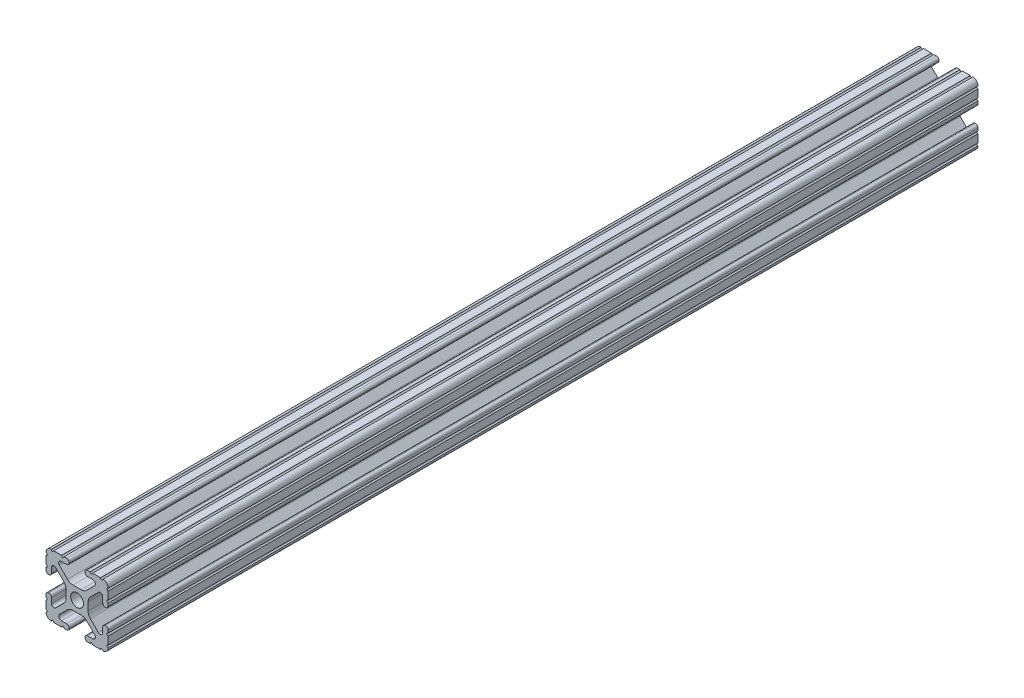
from build123d import *

# Parameters (mm, degrees)
SKETCH1_R           = 2.6035
BOSS_EXTRUDE1_DEPTH = 177.8


with BuildPart() as part:
    # Sketch1 → Boss-Extrude1 (new, symmetric)
    with BuildSketch(Plane.XY):
        with BuildLine():
            Line((-7.179650497, -8.645192506), (-3.952270251, -5.423690499))
            ThreePointArc((-3.952270251, -5.423690499), (-2.922936451, -4.736929036), (-1.709253557, -4.4958))
            Line((-1.709253557, -4.4958), (1.709253557, -4.4958))
            ThreePointArc((1.709253557, -4.4958), (2.922936451, -4.736929036), (3.952270251, -5.423690499))
            Line((3.952270251, -5.423690499), (7.179650497, -8.645192506))
            ThreePointArc((7.179650497, -8.645192506), (7.41473083, -9.822813117), (6.416408329, -10.4902))
            Line((6.416408329, -10.4902), (4.287512407, -10.4902))
            ThreePointArc((4.287512407, -10.4902), (3.54574862, -10.79744862), (3.2385, -11.539212407))
            Line((3.2385, -11.539212407), (3.2385, -11.650987593))
            ThreePointArc((3.2385, -11.650987593), (3.54574862, -12.39275138), (4.287512407, -12.7))
            Line((4.287512407, -12.7), (5.317126718, -12.7))
            ThreePointArc((5.317126718, -12.7), (5.825126718, -12.192), (6.333126718, -12.7))
            Line((6.333126718, -12.7), (9.550443118, -12.7))
            ThreePointArc((9.550443118, -12.7), (10.058366869, -12.192000006), (10.566443095, -12.699847501))
            ThreePointArc((10.566443095, -12.699847501), (12.082537762, -12.08250727), (12.699846982, -10.566399977))
            ThreePointArc((12.699846982, -10.566399977), (12.192000006, -10.058323491), (12.7, -9.5504))
            Line((12.7, -9.5504), (12.7, -6.3330836))
            ThreePointArc((12.7, -6.3330836), (12.192, -5.8250836), (12.7, -5.3170836))
            Line((12.7, -5.3170836), (12.7, -4.287469289))
            ThreePointArc((12.7, -4.287469289), (12.39275138, -3.545705502), (11.650987593, -3.238456882))
            Line((11.650987593, -3.238456882), (11.539212407, -3.238456882))
            ThreePointArc((11.539212407, -3.238456882), (10.79744862, -3.545705502), (10.4902, -4.287469289))
            Line((10.4902, -4.287469289), (10.4902, -6.402089023))
            ThreePointArc((10.4902, -6.402089023), (9.856505071, -7.351067942), (8.737131347, -7.129408934))
            Line((8.737131347, -7.129408934), (5.441005833, -3.840816462))
            ThreePointArc((5.441005833, -3.840816462), (4.750877967, -2.809883091), (4.5085, -1.593185507))
            Line((4.5085, -1.593185507), (4.5085, 1.593185507))
            ThreePointArc((4.5085, 1.593185507), (4.750877967, 2.809883091), (5.441005833, 3.840816462))
            Line((5.441005833, 3.840816462), (8.737131347, 7.129408934))
            ThreePointArc((8.737131347, 7.129408934), (9.856505071, 7.351067942), (10.4902, 6.402089023))
            Line((10.4902, 6.402089023), (10.4902, 4.287469289))
            ThreePointArc((10.4902, 4.287469289), (10.79744862, 3.545705502), (11.539212407, 3.238456882))
            Line((11.539212407, 3.238456882), (11.650987593, 3.238456882))
            ThreePointArc((11.650987593, 3.238456882), (12.39275138, 3.545705502), (12.7, 4.287469289))
            Line((12.7, 4.287469289), (12.7, 5.3170836))
            ThreePointArc((12.7, 5.3170836), (12.192, 5.8250836), (12.7, 6.3330836))
            Line((12.7, 6.3330836), (12.7, 9.5504))
            ThreePointArc((12.7, 9.5504), (12.192000006, 10.058323491), (12.699846982, 10.566399977))
            ThreePointArc((12.699846982, 10.566399977), (12.082537762, 12.08250727), (10.566443095, 12.699847501))
            ThreePointArc((10.566443095, 12.699847501), (10.058366869, 12.192000006), (9.550443118, 12.7))
            Line((9.550443118, 12.7), (6.333126718, 12.7))
            ThreePointArc((6.333126718, 12.7), (5.825126718, 12.192), (5.317126718, 12.7))
            Line((5.317126718, 12.7), (4.287512407, 12.7))
            ThreePointArc((4.287512407, 12.7), (3.54574862, 12.39275138), (3.2385, 11.650987593))
            Line((3.2385, 11.650987593), (3.2385, 11.539212407))
            ThreePointArc((3.2385, 11.539212407), (3.54574862, 10.79744862), (4.287512407, 10.4902))
            Line((4.287512407, 10.4902), (6.476788598, 10.4902))
            ThreePointArc((6.476788598, 10.4902), (7.432222385, 9.85140422), (7.207036008, 8.724370562))
            Line((7.207036008, 8.724370562), (3.898272566, 5.423169045))
            ThreePointArc((3.898272566, 5.423169045), (2.869120213, 4.736787962), (1.655778399, 4.4958))
            Line((1.655778399, 4.4958), (-1.655778399, 4.4958))
            ThreePointArc((-1.655778399, 4.4958), (-2.869120213, 4.736787962), (-3.898272566, 5.423169045))
            Line((-3.898272566, 5.423169045), (-7.207036008, 8.724370562))
            ThreePointArc((-7.207036008, 8.724370562), (-7.432222385, 9.85140422), (-6.476788598, 10.4902))
            Line((-6.476788598, 10.4902), (-4.287512407, 10.4902))
            ThreePointArc((-4.287512407, 10.4902), (-3.54574862, 10.79744862), (-3.2385, 11.539212407))
            Line((-3.2385, 11.539212407), (-3.2385, 11.650987593))
            ThreePointArc((-3.2385, 11.650987593), (-3.54574862, 12.39275138), (-4.287512407, 12.7))
            Line((-4.287512407, 12.7), (-5.317126718, 12.7))
            ThreePointArc((-5.317126718, 12.7), (-5.825126718, 12.192), (-6.333126718, 12.7))
            Line((-6.333126718, 12.7), (-9.550443118, 12.7))
            ThreePointArc((-9.550443118, 12.7), (-10.058366869, 12.192000006), (-10.566443095, 12.699847501))
            ThreePointArc((-10.566443095, 12.699847501), (-12.082537762, 12.08250727), (-12.699846982, 10.566399977))
            ThreePointArc((-12.699846982, 10.566399977), (-12.192000006, 10.058323491), (-12.7, 9.5504))
            Line((-12.7, 9.5504), (-12.7, 6.3330836))
            ThreePointArc((-12.7, 6.3330836), (-12.192, 5.8250836), (-12.7, 5.3170836))
            Line((-12.7, 5.3170836), (-12.7, 4.287469289))
            ThreePointArc((-12.7, 4.287469289), (-12.39275138, 3.545705502), (-11.650987593, 3.238456882))
            Line((-11.650987593, 3.238456882), (-11.539212407, 3.238456882))
            ThreePointArc((-11.539212407, 3.238456882), (-10.79744862, 3.545705502), (-10.4902, 4.287469289))
            Line((-10.4902, 4.287469289), (-10.4902, 6.402089023))
            ThreePointArc((-10.4902, 6.402089023), (-9.856505071, 7.351067942), (-8.737131347, 7.129408934))
            Line((-8.737131347, 7.129408934), (-5.441005833, 3.840816462))
            ThreePointArc((-5.441005833, 3.840816462), (-4.750877967, 2.809883091), (-4.5085, 1.593185507))
            Line((-4.5085, 1.593185507), (-4.5085, -1.593185507))
            ThreePointArc((-4.5085, -1.593185507), (-4.750877967, -2.809883091), (-5.441005833, -3.840816462))
            Line((-5.441005833, -3.840816462), (-8.737131347, -7.129408934))
            ThreePointArc((-8.737131347, -7.129408934), (-9.856505071, -7.351067942), (-10.4902, -6.402089023))
            Line((-10.4902, -6.402089023), (-10.4902, -4.287469289))
            ThreePointArc((-10.4902, -4.287469289), (-10.79744862, -3.545705502), (-11.539212407, -3.238456882))
            Line((-11.539212407, -3.238456882), (-11.650987593, -3.238456882))
            ThreePointArc((-11.650987593, -3.238456882), (-12.39275138, -3.545705502), (-12.7, -4.287469289))
            Line((-12.7, -4.287469289), (-12.7, -5.3170836))
            ThreePointArc((-12.7, -5.3170836), (-12.192, -5.8250836), (-12.7, -6.3330836))
            Line((-12.7, -6.3330836), (-12.7, -9.5504))
            ThreePointArc((-12.7, -9.5504), (-12.192000006, -10.058323491), (-12.699846982, -10.566399977))
            ThreePointArc((-12.699846982, -10.566399977), (-12.082537762, -12.08250727), (-10.566443095, -12.699847501))
            ThreePointArc((-10.566443095, -12.699847501), (-10.058366869, -12.192000006), (-9.550443118, -12.7))
            Line((-9.550443118, -12.7), (-6.333126718, -12.7))
            ThreePointArc((-6.333126718, -12.7), (-5.825126718, -12.192), (-5.317126718, -12.7))
            Line((-5.317126718, -12.7), (-4.287512407, -12.7))
            ThreePointArc((-4.287512407, -12.7), (-3.54574862, -12.39275138), (-3.2385, -11.650987593))
            Line((-3.2385, -11.650987593), (-3.2385, -11.539212407))
            ThreePointArc((-3.2385, -11.539212407), (-3.54574862, -10.79744862), (-4.287512407, -10.4902))
            Line((-4.287512407, -10.4902), (-6.416408329, -10.4902))
            ThreePointArc((-6.416408329, -10.4902), (-7.41473083, -9.822813117), (-7.179650497, -8.645192506))
        make_face()
        Circle(SKETCH1_R, mode=Mode.SUBTRACT)
    extrude(amount=BOSS_EXTRUDE1_DEPTH, both=True)


solid = part.part
